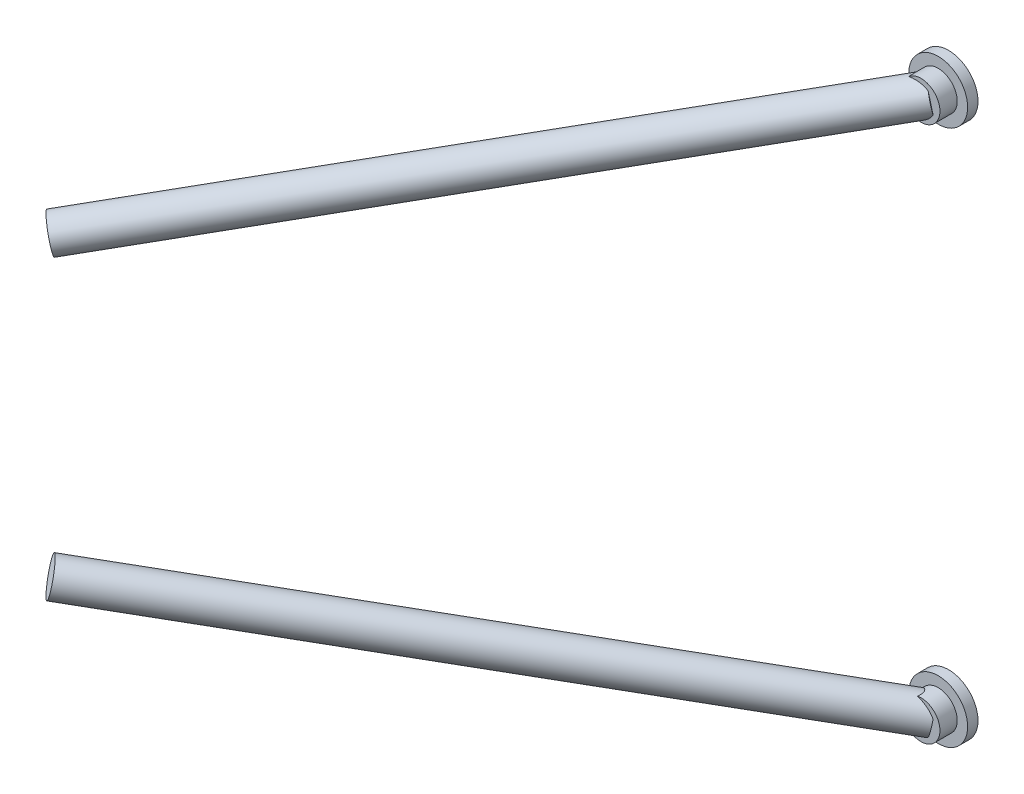
from build123d import *

# Parameters (mm, degrees)
PIPE_SKETCH_1_R     = 10
PIPE_1_DEPTH        = 366.472372765
PIPE_ROTATE_1_ANGLE = 164.859016165
PIPE_ROTATE_2_ANGLE = 43.875570355
PIPE_ROTATE_3_ANGLE = 143.476188317
EXTRUDE_START       = 303
EXTRUDE_SKETCH_1_R  = 17
EXTRUDE_1_DEPTH     = 6
EXTRUDE_START_2     = 309
EXTRUDE_SKETCH_2_R  = 11
EXTRUDE_2_DEPTH     = 10
PIPE_SKETCH_2_R     = 10
PIPE_2_DEPTH        = 366.472372765
PIPE_ROTATE_4_ANGLE = 164.859016165
PIPE_ROTATE_5_ANGLE = 43.875570355
PIPE_ROTATE_6_ANGLE = 143.476188317
EXTRUDE_SKETCH_3_R  = 17
EXTRUDE_3_DEPTH     = 6
EXTRUDE_SKETCH_4_R  = 11
EXTRUDE_4_DEPTH     = 10


with BuildPart() as part:
    # Pipe sketch 1 → Pipe 1 (new body)
    with BuildSketch(Plane.XY):
        Circle(PIPE_SKETCH_1_R)
    extrude(amount=PIPE_1_DEPTH)


with BuildPart() as part_1:
    # Pipe rotate 1: moved
    add(part.part.rotate(Axis((0, 0, 0), (-1, 0, 0)), PIPE_ROTATE_1_ANGLE))


with BuildPart() as part_2:
    # Pipe rotate 2: moved
    add(part_1.part.rotate(Axis((0, 0, 0), (0, 1, 0)), PIPE_ROTATE_2_ANGLE))


with BuildPart() as part_3:
    # Pipe rotate 3: moved
    add(part_2.part.rotate(Axis((0, 0, 0), (0, 0, -1)), PIPE_ROTATE_3_ANGLE))


with BuildPart() as part_4:
    # Pipe place 1: moved
    add(part_3.part.moved(Location((126, 86, 568))))


with BuildPart() as body_2:
    # Extrude sketch 1 → Extrude 1 (new body)
    with BuildSketch(Plane.XY.offset(EXTRUDE_START)):
        with Locations((380, 155)):
            Circle(EXTRUDE_SKETCH_1_R)
    extrude(amount=EXTRUDE_1_DEPTH)


with BuildPart() as body_3:
    # Extrude sketch 2 → Extrude 2 (new body)
    with BuildSketch(Plane.XY.offset(EXTRUDE_START_2)):
        with Locations((380, 155)):
            Circle(EXTRUDE_SKETCH_2_R)
    extrude(amount=EXTRUDE_2_DEPTH)


with BuildPart() as body_4:
    # Pipe sketch 2 → Pipe 2 (new body)
    with BuildSketch(Plane.XY):
        Circle(PIPE_SKETCH_2_R)
    extrude(amount=PIPE_2_DEPTH)


with BuildPart() as body_4_1:
    # Pipe rotate 4: moved
    add(body_4.part.rotate(Axis((0, 0, 0), (1, 0, 0)), PIPE_ROTATE_4_ANGLE))


with BuildPart() as body_4_2:
    # Pipe rotate 5: moved
    add(body_4_1.part.rotate(Axis((0, 0, 0), (0, 1, 0)), PIPE_ROTATE_5_ANGLE))


with BuildPart() as body_4_3:
    # Pipe rotate 6: moved
    add(body_4_2.part.rotate(Axis((0, 0, 0), (0, 0, 1)), PIPE_ROTATE_6_ANGLE))


with BuildPart() as body_4_4:
    # Pipe place 2: moved
    add(body_4_3.part.moved(Location((126, -86, 568))))


with BuildPart() as body_5:
    # Extrude sketch 3 → Extrude 3 (new body)
    with BuildSketch(Plane.XY.offset(EXTRUDE_START)):
        with Locations((380, -155)):
            Circle(EXTRUDE_SKETCH_3_R)
    extrude(amount=EXTRUDE_3_DEPTH)


with BuildPart() as body_6:
    # Extrude sketch 4 → Extrude 4 (new body)
    with BuildSketch(Plane.XY.offset(EXTRUDE_START_2)):
        with Locations((380, -155)):
            Circle(EXTRUDE_SKETCH_4_R)
    extrude(amount=EXTRUDE_4_DEPTH)


solid = Compound([part_4.part, body_2.part, body_3.part, body_4_4.part, body_5.part, body_6.part])
